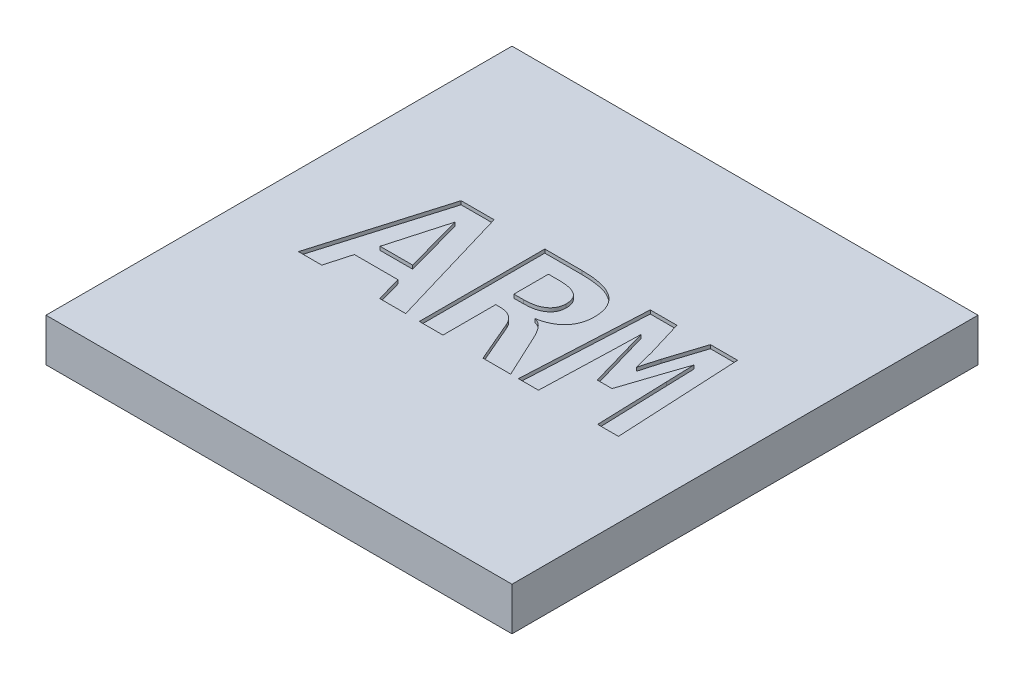
from build123d import *

# Parameters (mm, degrees)
SKETCH_1_W          = 13
SKETCH_1_H          = 13
EXTRUDE_1_DEPTH     = 1.2
CUT_EXTRUDE_1_DEPTH = 0.1


with BuildPart() as part:
    # 스케치1 → 보스-돌출1 (new body)
    with BuildSketch(Plane(origin=(0, 0, 0), x_dir=(1, 0, 0), z_dir=(0, 1, 0))):
        with Locations((6.5, 6.5)):
            Rectangle(SKETCH_1_W, SKETCH_1_H)
    extrude(amount=EXTRUDE_1_DEPTH)

    # 스케치2 → 컷-돌출1 (cut)
    # profile 1 of 3: a face of its own
    with BuildSketch(Plane(origin=(0, 1.2, 0), x_dir=(1, 0, 0), z_dir=(0, 1, 0))):
        Polygon((4.250679348, 5.056307), (4.055706522, 5.766451927), (2.837522645, 5.766451927), (2.637794384, 5.056307), (1.985507246, 5.056307), (3.023777174, 8.556307), (3.943953804, 8.556307), (4.97826087, 5.056307), align=None)
        Polygon((3.456521739, 7.956329645), (2.996037138, 6.324422942), (3.903532609, 6.324422942), align=None, mode=Mode.SUBTRACT)
    # profile 2 of 3: a face of its own
    with BuildSketch(Plane(origin=(0, 1.2, 0), x_dir=(1, 0, 0), z_dir=(0, 1, 0))):
        with BuildLine():
            Line((7.134057971, 5.056307), (6.645040761, 6.19840392))
            add(Edge.make_bspline(
                [(6.645040761, 6.19840392), (6.633140099, 6.224457557), (6.610014837, 6.275084758), (6.563209444, 6.342128185), (6.509811234, 6.399411177), (6.448644022, 6.445682133), (6.381682405, 6.482444974), (6.308539756, 6.509067271), (6.229531944, 6.523845527), (6.175103907, 6.526146361), (6.147305254, 6.527321493)],
                knots=[0, 0, 0, 0, 1.07937985, 2.097441539, 3.071055259, 4.024539089, 4.97969058, 5.945096662, 6.95047571, 8, 8, 8, 8], degree=3))
            Line((6.147305254, 6.527321493), (6.018115942, 6.527321493))
            Line((6.018115942, 6.527321493), (6.018115942, 5.056307))
            Line((6.018115942, 5.056307), (5.358695652, 5.056307))
            Line((5.358695652, 5.056307), (5.358695652, 8.556307))
            Line((5.358695652, 8.556307), (6.39696558, 8.556307))
            add(Edge.make_bspline(
                [(6.39696558, 8.556307), (6.44505717, 8.555625641), (6.538943451, 8.554295466), (6.676327112, 8.546059268), (6.806380562, 8.529765303), (6.929644175, 8.508976612), (7.045344555, 8.480766902), (7.152892252, 8.444777918), (7.251035462, 8.399228962), (7.340359594, 8.345941352), (7.421212147, 8.285103341), (7.491613585, 8.214455993), (7.552224164, 8.135276977), (7.603648187, 8.047491351), (7.643248856, 7.949743303), (7.671665885, 7.842199248), (7.689364198, 7.72442637), (7.691119029, 7.642272434), (7.692028986, 7.599672036)],
                knots=[0, 0, 0, 0, 1.254438722, 2.448964256, 3.587437174, 4.671603447, 5.707801299, 6.690588177, 7.624750448, 8.524079809, 9.399245701, 10.256818247, 11.116851234, 11.993805779, 12.902354155, 13.858471343, 14.889524007, 16, 16, 16, 16], degree=3))
            add(Edge.make_bspline(
                [(7.692028986, 7.599672036), (7.691239008, 7.568729477), (7.689701007, 7.508487697), (7.67857865, 7.420582401), (7.659612629, 7.33803397), (7.633373986, 7.26083316), (7.600627828, 7.188931064), (7.561886691, 7.122064044), (7.516214192, 7.06058734), (7.464777001, 7.004463206), (7.408086514, 6.95379773), (7.347469348, 6.907176769), (7.281836186, 6.866190289), (7.211821483, 6.830802554), (7.13891719, 6.799526164), (7.062639527, 6.774610517), (6.983843926, 6.753518878), (6.929921739, 6.743838474), (6.902626812, 6.73893834)],
                knots=[0, 0, 0, 0, 1.155349972, 2.249340124, 3.302347646, 4.313193118, 5.288908417, 6.248327119, 7.193487508, 8.143168254, 9.086215168, 10.029416886, 10.995709606, 11.970826185, 12.956664107, 13.955010984, 14.964844911, 16, 16, 16, 16], degree=3))
            add(Edge.make_bspline(
                [(6.902626812, 6.73893834), (6.923791025, 6.733389456), (6.966851888, 6.722099656), (7.027441412, 6.689635303), (7.085715125, 6.647405354), (7.141142197, 6.592932019), (7.194441134, 6.525586953), (7.248087068, 6.445630446), (7.301022677, 6.351561616), (7.333914569, 6.283407325), (7.351222826, 6.247543413)],
                knots=[0, 0, 0, 0, 0.75991202, 1.546122521, 2.376404305, 3.261596413, 4.243343524, 5.3639781, 6.612881775, 8, 8, 8, 8], degree=3))
            Line((7.351222826, 6.247543413), (7.906816123, 5.056307))
            Line((7.906816123, 5.056307), (7.134057971, 5.056307))
        make_face()
        with BuildLine():
            add(Edge.make_bspline(
                [(6.981884058, 7.528340514), (6.981504962, 7.548443488), (6.980768494, 7.587497473), (6.97288702, 7.643906223), (6.959177112, 7.695888053), (6.941354104, 7.743464314), (6.917779005, 7.786814444), (6.888480303, 7.825348904), (6.85415561, 7.859861657), (6.814341891, 7.8894352), (6.770019497, 7.915597864), (6.720166621, 7.937703476), (6.665384141, 7.956898026), (6.605021149, 7.971449032), (6.539670856, 7.983441688), (6.468997822, 7.991891457), (6.393100108, 7.99771625), (6.340704806, 7.998125441), (6.313745471, 7.998335985)],
                knots=[0, 0, 0, 0, 1.03221539, 2.00528173, 2.91708139, 3.789130794, 4.609038712, 5.442315575, 6.267597059, 7.100873922, 7.98300273, 8.906244241, 9.897686097, 10.9608414, 12.092146654, 13.309174969, 14.615470257, 16, 16, 16, 16], degree=3))
            Line((6.313745471, 7.998335985), (6.018115942, 7.998335985))
            Line((6.018115942, 7.998335985), (6.018115942, 7.034567869))
            Line((6.018115942, 7.034567869), (6.291553442, 7.034567869))
            add(Edge.make_bspline(
                [(6.291553442, 7.034567869), (6.341322659, 7.035985514), (6.436681628, 7.038701754), (6.552097974, 7.058540895), (6.636338433, 7.08131439), (6.692892375, 7.104289198), (6.74553881, 7.129163549), (6.793316435, 7.158720954), (6.836485578, 7.191818863), (6.873724603, 7.229589267), (6.906802207, 7.270052793), (6.933921834, 7.314901578), (6.95514363, 7.363467605), (6.97148897, 7.415152604), (6.979928216, 7.47073524), (6.981219446, 7.508765729), (6.981884058, 7.528340514)],
                knots=[0, 0, 0, 0, 2.184691281, 4.185918933, 5.126368008, 6.012027286, 6.863184627, 7.681184451, 8.47504028, 9.246354907, 10.005704987, 10.765941227, 11.540044168, 12.329221459, 13.140028664, 14, 14, 14, 14], degree=3))
        make_face(mode=Mode.SUBTRACT)
    # profile 3 of 3: a face of its own
    with BuildSketch(Plane(origin=(0, 1.2, 0), x_dir=(1, 0, 0), z_dir=(0, 1, 0))):
        Polygon((10.332880435, 5.056307), (10.266304348, 7.040115877), (10.240942029, 7.831895768), (10.068161232, 7.327027109), (9.669497283, 6.121524391), (9.257359601, 6.121524391), (8.911005435, 7.327027109), (8.765964674, 7.831895768), (8.74535779, 7.055967326), (8.681951993, 5.056307), (8.123188406, 5.056307), (8.300724638, 8.556307), (9.044157609, 8.556307), (9.347712862, 7.548154826), (9.492753623, 6.979880369), (9.644927536, 7.515659355), (9.978600543, 8.556307), (10.735507246, 8.556307), (10.913043478, 5.056307), align=None)
    extrude(amount=-CUT_EXTRUDE_1_DEPTH, mode=Mode.SUBTRACT)


solid = part.part
